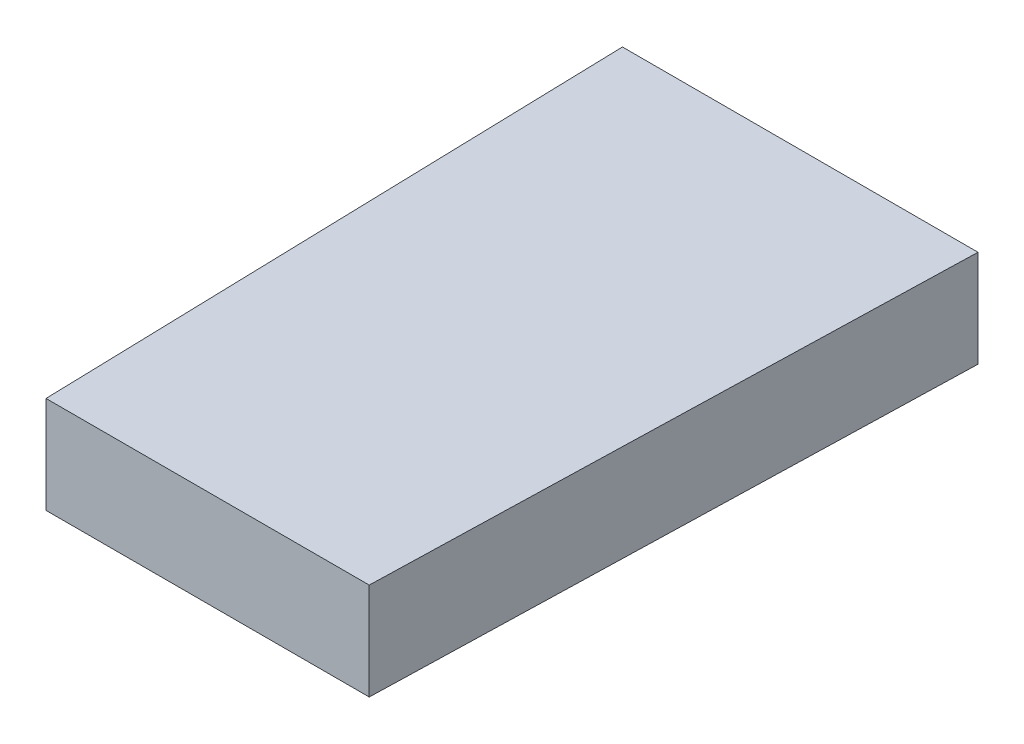
from build123d import *

# Parameters (mm, degrees)
BOSS_EXTRUDE1_DEPTH = 4.5


with BuildPart() as part:
    # Sketch1 → Boss-Extrude1 (new, symmetric)
    with BuildSketch(Plane(origin=(0, 0, 0), x_dir=(1, 0, 0), z_dir=(0, 1, 0))):
        Polygon((-16.5, 27.5), (-15, -27.5), (15, -27.5), (16.5, 27.5), align=None)
    extrude(amount=BOSS_EXTRUDE1_DEPTH, both=True)


solid = part.part
